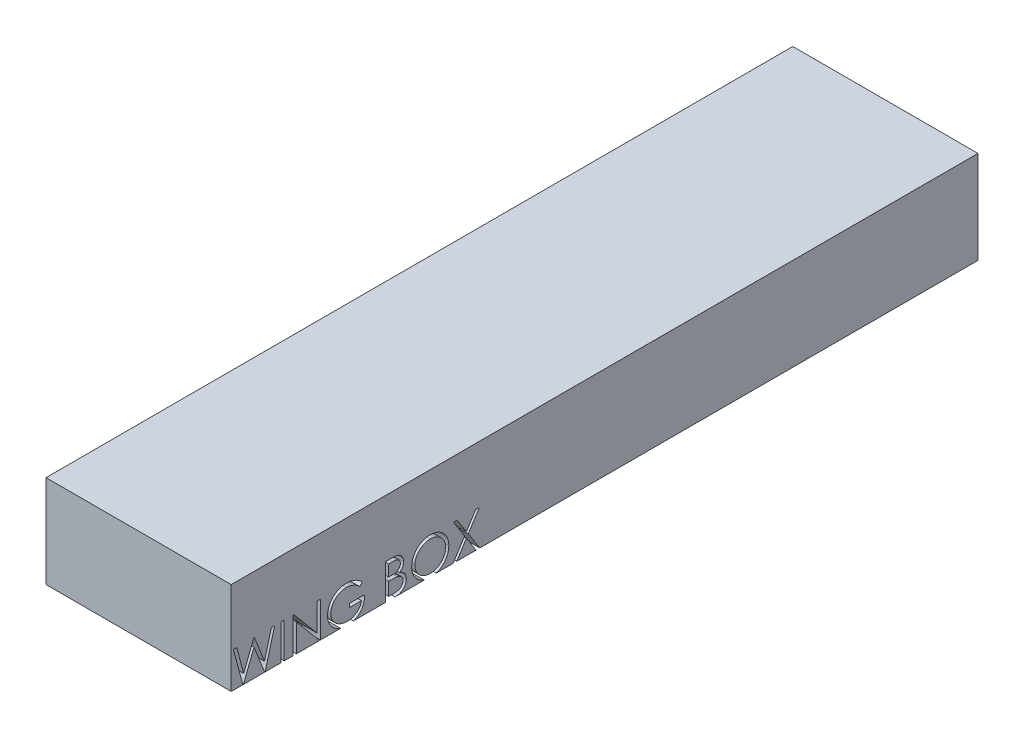
from build123d import *

# Parameters (mm, degrees)
SKETCH1_W           = 403.2
SKETCH1_H           = 50
BOSS_EXTRUDE1_DEPTH = 50
SKETCH2_W           = 1.709615385
SKETCH2_H           = 19.05
CUT_EXTRUDE1_DEPTH  = 10


with BuildPart() as part:
    # Sketch1 → Boss-Extrude1 (new, symmetric)
    with BuildSketch(Plane(origin=(0, 0, 0), x_dir=(0, 0, -1), z_dir=(1, 0, 0))):
        with Locations((-201.6, 25)):
            Rectangle(SKETCH1_W, SKETCH1_H)
    extrude(amount=BOSS_EXTRUDE1_DEPTH, both=True)

    # Sketch2 → Cut-Extrude1 (cut)
    # profile 1 of 7: a face of its own
    with BuildSketch(Plane(origin=(50, 0, 0), x_dir=(0, 0, -1), z_dir=(1, 0, 0))):
        Polygon((-401.978846154, 19.05), (-400.215805288, 19.05), (-396.483653846, 5.067788462), (-390.942668269, 19.05), (-390.694621394, 19.05), (-385.249038462, 5.174639423), (-381.501622596, 19.05), (-379.753846154, 19.05), (-384.890324519, 0), (-385.134555288, 0), (-390.866346154, 14.562259615), (-396.659194712, 0), (-396.907241587, 0), align=None)
    # profile 2 of 7: a face of its own
    with BuildSketch(Plane(origin=(50, 0, 0), x_dir=(0, 0, -1), z_dir=(1, 0, 0))):
        with Locations((-375.479807693, 9.525)):
            Rectangle(SKETCH2_W, SKETCH2_H)
    # profile 3 of 7: a face of its own
    with BuildSketch(Plane(origin=(50, 0, 0), x_dir=(0, 0, -1), z_dir=(1, 0, 0))):
        Polygon((-369.740384615, 0), (-369.740384615, 19.05), (-369.381670673, 19.05), (-356.796153846, 4.056520433), (-356.796153846, 19.05), (-355.086538462, 19.05), (-355.086538462, 0), (-355.47578125, 0), (-368.030769231, 14.959134615), (-368.030769231, 0), align=None)
    # profile 4 of 7: a face of its own
    with BuildSketch(Plane(origin=(50, 0, 0), x_dir=(0, 0, -1), z_dir=(1, 0, 0))):
        with BuildLine():
            Line((-332.373076923, 15.798677885), (-333.838461538, 14.409615385))
            add(Edge.make_bspline(
                [(-333.838461538, 14.409615385), (-334.103631487, 14.659066225), (-334.627648254, 15.152019607), (-335.481960432, 15.791615166), (-336.373302497, 16.339526369), (-337.297023373, 16.785330313), (-338.230247788, 17.141036052), (-339.160588699, 17.394282072), (-340.078503159, 17.555785455), (-340.689013305, 17.575098722), (-340.98984375, 17.584615385)],
                knots=[0, 0, 0, 0, 1.08915593, 2.152340314, 3.188132944, 4.216796309, 5.218260357, 6.173443236, 7.099959455, 8, 8, 8, 8], degree=3))
            add(Edge.make_bspline(
                [(-340.98984375, 17.584615385), (-341.174436617, 17.582364187), (-341.543143601, 17.57786763), (-342.090814468, 17.520476972), (-342.632741449, 17.437936784), (-343.167901532, 17.318510278), (-343.697335247, 17.16714954), (-344.219201247, 16.977817233), (-344.73447302, 16.757080832), (-345.238296976, 16.502015082), (-345.726741716, 16.221817632), (-346.188061065, 15.911310576), (-346.625195421, 15.580445877), (-347.029928593, 15.220939831), (-347.404588681, 14.836048921), (-347.758093391, 14.432932927), (-348.078009816, 14.00057838), (-348.366977442, 13.546940044), (-348.624759965, 13.079985414), (-348.852318494, 12.604208998), (-349.043346931, 12.121188876), (-349.194492109, 11.63031894), (-349.319191525, 11.135396729), (-349.406917358, 10.632995322), (-349.456375089, 10.122576777), (-349.464930063, 9.780780271), (-349.469230769, 9.608954327)],
                knots=[0, 0, 0, 0, 1.02818874, 2.053710826, 3.065248034, 4.081641283, 5.106893873, 6.131558223, 7.173050175, 8.228653731, 9.27666206, 10.308777013, 11.325269123, 12.329503258, 13.32196095, 14.316845687, 15.314881793, 16.315733098, 17.311955233, 18.285320748, 19.252783886, 20.203351036, 21.145449891, 22.095197417, 23.042428769, 24, 24, 24, 24], degree=3))
            add(Edge.make_bspline(
                [(-349.469230769, 9.608954327), (-349.465117503, 9.433308879), (-349.456902201, 9.082497612), (-349.404322462, 8.558927017), (-349.306741611, 8.04313247), (-349.176288795, 7.53341906), (-349.013107498, 7.028913839), (-348.809693416, 6.531804035), (-348.568762076, 6.042108049), (-348.289888843, 5.564238162), (-347.984075364, 5.098748564), (-347.641485166, 4.660274595), (-347.277572562, 4.242977393), (-346.879079764, 3.856122165), (-346.458784827, 3.489361244), (-346.004130582, 3.152799331), (-345.52405719, 2.839953573), (-345.017832222, 2.554766804), (-344.490948507, 2.299994631), (-343.950708179, 2.07344171), (-343.395385354, 1.886864175), (-342.827898429, 1.734801066), (-342.248923907, 1.610158019), (-341.655522924, 1.529971233), (-341.052058611, 1.471782568), (-340.645266914, 1.46752805), (-340.440324519, 1.465384615)],
                knots=[0, 0, 0, 0, 0.93586088, 1.869166235, 2.799637598, 3.729985548, 4.670839027, 5.622275134, 6.589130586, 7.576015415, 8.568469353, 9.55398029, 10.53834874, 11.515998671, 12.510579167, 13.508179873, 14.527009472, 15.561807829, 16.601455013, 17.643573243, 18.680854198, 19.719860599, 20.772568776, 21.833555941, 22.908541556, 24, 24, 24, 24], degree=3))
            add(Edge.make_bspline(
                [(-340.440324519, 1.465384615), (-340.193336658, 1.470547581), (-339.708335865, 1.480685902), (-338.995395369, 1.559608906), (-338.310667227, 1.682872168), (-337.656075464, 1.863389406), (-337.030859794, 2.093642266), (-336.432728213, 2.371202869), (-335.8663899, 2.706717234), (-335.330142341, 3.085397853), (-334.836163946, 3.507300013), (-334.390643642, 3.962564833), (-334.000687479, 4.448982453), (-333.66048333, 4.963687955), (-333.379040511, 5.510941686), (-333.148030441, 6.088061776), (-332.970956382, 6.695307805), (-332.898267162, 7.114906544), (-332.861538462, 7.326923077)],
                knots=[0, 0, 0, 0, 1.13008108, 2.219097802, 3.278683437, 4.311054135, 5.322181354, 6.324827112, 7.324222904, 8.330512327, 9.32562643, 10.293043162, 11.24128371, 12.174520618, 13.111833804, 14.052305215, 15.015860969, 16, 16, 16, 16], degree=3))
            Line((-332.861538462, 7.326923077), (-339.211538462, 7.326923077))
            Line((-339.211538462, 7.326923077), (-339.211538462, 9.280769231))
            Line((-339.211538462, 9.280769231), (-331.151923077, 9.280769231))
            add(Edge.make_bspline(
                [(-331.151923077, 9.280769231), (-331.161207766, 8.916601327), (-331.17937958, 8.203858957), (-331.306845392, 7.164435054), (-331.512675266, 6.182697695), (-331.793854963, 5.257612977), (-332.15784756, 4.39049185), (-332.600746608, 3.580453922), (-333.129640581, 2.832732273), (-333.72569027, 2.141222696), (-334.394617183, 1.524387984), (-335.118346386, 0.982247093), (-335.8980736, 0.525577144), (-336.733061266, 0.15404411), (-337.620575911, -0.135918634), (-338.562671235, -0.341503929), (-339.558069662, -0.464675587), (-340.240259289, -0.480412952), (-340.589152644, -0.488461538)],
                knots=[0, 0, 0, 0, 1.140356446, 2.231883559, 3.274166699, 4.278491846, 5.25512956, 6.21435461, 7.1637429, 8.11826594, 9.068280886, 10.0076534, 10.945064095, 11.891975133, 12.864533718, 13.863980011, 14.907571808, 16, 16, 16, 16], degree=3))
            add(Edge.make_bspline(
                [(-340.589152644, -0.488461538), (-340.804200667, -0.485363893), (-341.228344676, -0.479254337), (-341.854768156, -0.435834775), (-342.463919776, -0.368993353), (-343.055710796, -0.268054895), (-343.632318059, -0.144422277), (-344.190861799, 0.013892578), (-344.73346971, 0.197146499), (-345.26098046, 0.405584378), (-345.768606065, 0.647092967), (-346.258607536, 0.91547829), (-346.733693449, 1.20935644), (-347.190627647, 1.533809757), (-347.631790929, 1.886411433), (-348.054338672, 2.267868192), (-348.460636409, 2.677013858), (-348.715146932, 2.967548182), (-348.843389423, 3.113942308)],
                knots=[0, 0, 0, 0, 1.107784379, 2.184907829, 3.233506516, 4.263428166, 5.276301166, 6.270063455, 7.25232949, 8.225834625, 9.190232166, 10.146266622, 11.1027726, 12.066435141, 13.031522626, 14.010570082, 14.99756817, 16, 16, 16, 16], degree=3))
            add(Edge.make_bspline(
                [(-348.843389423, 3.113942308), (-349.029458567, 3.346192576), (-349.398508299, 3.806837998), (-349.873550837, 4.544889124), (-350.278507044, 5.309076392), (-350.607080475, 6.101527155), (-350.863646345, 6.921500185), (-351.04764895, 7.767947698), (-351.155457195, 8.641959687), (-351.170988592, 9.233409199), (-351.178846154, 9.532632212)],
                knots=[0, 0, 0, 0, 1.023165419, 2.029347347, 3.013907458, 3.994755782, 4.975994455, 5.96558838, 6.970761222, 8, 8, 8, 8], degree=3))
            add(Edge.make_bspline(
                [(-351.178846154, 9.532632212), (-351.175949258, 9.756694244), (-351.170192283, 10.201970617), (-351.100384831, 10.863045391), (-351.000228542, 11.512382015), (-350.853015287, 12.1494497), (-350.667434189, 12.774673921), (-350.435821644, 13.388344982), (-350.166155853, 13.990825026), (-349.852726224, 14.577967079), (-349.503923666, 15.141979954), (-349.125371753, 15.680593141), (-348.711695014, 16.183997909), (-348.26964902, 16.658569594), (-347.793959687, 17.098346176), (-347.289083395, 17.507399264), (-346.754631058, 17.886277561), (-346.188921278, 18.229013376), (-345.600397738, 18.536881081), (-344.990471159, 18.806788077), (-344.359327727, 19.029854408), (-343.711695884, 19.219123123), (-343.042673488, 19.359086959), (-342.357115494, 19.460589416), (-341.651448456, 19.530043537), (-341.174458068, 19.535629301), (-340.932602163, 19.538461538)],
                knots=[0, 0, 0, 0, 1.008945113, 2.00506715, 2.99143336, 3.967273523, 4.948097931, 5.927297278, 6.919902385, 7.919676788, 8.923139349, 9.905703106, 10.883022732, 11.856032218, 12.825136022, 13.798837087, 14.781400844, 15.773989409, 16.776158564, 17.77167057, 18.775803737, 19.789618931, 20.80898985, 21.851988756, 22.910860228, 24, 24, 24, 24], degree=3))
            add(Edge.make_bspline(
                [(-340.932602163, 19.538461538), (-340.73536258, 19.535307448), (-340.344259664, 19.529053256), (-339.762278179, 19.485702815), (-339.189292199, 19.416992833), (-338.624452134, 19.323229895), (-338.069681483, 19.195520379), (-337.523399844, 19.042694287), (-336.984815325, 18.864757367), (-336.455615855, 18.652546646), (-335.932243143, 18.411680488), (-335.411787126, 18.140553146), (-334.896026087, 17.834528478), (-334.384065602, 17.492697806), (-333.87267729, 17.12093206), (-333.369949737, 16.708598491), (-332.863747997, 16.271957492), (-332.538255266, 15.958001605), (-332.373076923, 15.798677885)],
                knots=[0, 0, 0, 0, 0.985871117, 1.954866573, 2.915460327, 3.869826059, 4.81536089, 5.759505086, 6.70452669, 7.649098992, 8.607881297, 9.583363685, 10.581137262, 11.603961102, 12.659522466, 13.73993555, 14.853081303, 16, 16, 16, 16], degree=3))
        make_face()
    # profile 5 of 7: a face of its own
    with BuildSketch(Plane(origin=(50, 0, 0), x_dir=(0, 0, -1), z_dir=(1, 0, 0))):
        with BuildLine():
            Line((-319.917307692, 19.05), (-316.200420673, 19.05))
            add(Edge.make_bspline(
                [(-316.200420673, 19.05), (-316.018474242, 19.049043416), (-315.665816776, 19.047189317), (-315.152993814, 19.018433989), (-314.672668144, 18.979225443), (-314.224700469, 18.917013082), (-313.809297789, 18.841946409), (-313.42520822, 18.75104081), (-313.07365314, 18.642038813), (-312.653939532, 18.468704053), (-312.175399935, 18.211130809), (-311.657248683, 17.830519618), (-311.214177037, 17.36497864), (-310.832162939, 16.83983733), (-310.528445417, 16.262155487), (-310.308721099, 15.645701902), (-310.169613234, 14.99842785), (-310.155307042, 14.554055696), (-310.148076923, 14.329477163)],
                knots=[0, 0, 0, 0, 1.001505555, 1.941167018, 2.826882275, 3.653841531, 4.429895133, 5.150066043, 5.825578002, 6.45369114, 7.647487171, 8.808567382, 9.977351308, 11.170798116, 12.373658725, 13.556498008, 14.765093433, 16, 16, 16, 16], degree=3))
            add(Edge.make_bspline(
                [(-310.148076923, 14.329477163), (-310.154027155, 14.119096825), (-310.165719922, 13.705679619), (-310.277531226, 13.101010253), (-310.45257715, 12.525421476), (-310.695901435, 11.981013921), (-311.0121423, 11.480088113), (-311.386928291, 11.018603136), (-311.839103459, 10.616098097), (-312.177884522, 10.391074585), (-312.349969952, 10.276772837)],
                knots=[0, 0, 0, 0, 1.044552857, 2.05264487, 3.044412934, 4.028983338, 5.005914585, 5.980388656, 6.974128949, 8, 8, 8, 8], degree=3))
            add(Edge.make_bspline(
                [(-312.349969952, 10.276772837), (-312.133559625, 10.193687628), (-311.71951306, 10.034725042), (-311.149722049, 9.753680588), (-310.658804393, 9.447998245), (-310.242985641, 9.114177746), (-309.887362119, 8.754356933), (-309.576831109, 8.363259811), (-309.311865344, 7.935784572), (-309.08482786, 7.476388187), (-308.90766963, 6.989761552), (-308.774995065, 6.480469185), (-308.698972235, 5.95033732), (-308.688153787, 5.589555469), (-308.682692308, 5.407421875)],
                knots=[0, 0, 0, 0, 1.27268992, 2.434971085, 3.483601985, 4.442670788, 5.356604649, 6.2567628, 7.179492994, 8.113709626, 9.066344395, 10.018646069, 10.999752585, 12, 12, 12, 12], degree=3))
            add(Edge.make_bspline(
                [(-308.682692308, 5.407421875), (-308.688009141, 5.221456471), (-308.69847016, 4.855564329), (-308.77564972, 4.318054239), (-308.90632786, 3.804384887), (-309.086329385, 3.311233821), (-309.321255697, 2.839555089), (-309.607157903, 2.388814324), (-309.948052557, 1.963540324), (-310.329394743, 1.559007461), (-310.760807278, 1.195273362), (-311.226257316, 0.871337873), (-311.731606571, 0.604931449), (-312.268555281, 0.381142817), (-312.843126773, 0.210197923), (-313.452740965, 0.090604342), (-314.096872093, 0.010022641), (-314.538885167, 0.003397568), (-314.765564904, 0)],
                knots=[0, 0, 0, 0, 0.978564426, 1.925352924, 2.850884081, 3.763762016, 4.682927383, 5.618979971, 6.567305752, 7.547517671, 8.540179244, 9.531824382, 10.526200242, 11.540722885, 12.589160233, 13.674978461, 14.80764778, 16, 16, 16, 16], degree=3))
            Line((-314.765564904, 0), (-319.917307692, 0))
            Line((-319.917307692, 0), (-319.917307692, 19.05))
        make_face()
        with BuildLine():
            Line((-318.207692308, 17.096153846), (-318.207692308, 10.990384615))
            Line((-318.207692308, 10.990384615), (-317.059044471, 10.990384615))
            add(Edge.make_bspline(
                [(-317.059044471, 10.990384615), (-316.891138885, 10.992561339), (-316.566711075, 10.996767213), (-316.09688421, 11.00881507), (-315.660775182, 11.042550135), (-315.259136776, 11.076275504), (-314.892601474, 11.131110046), (-314.561981314, 11.196381458), (-314.262087522, 11.265412698), (-313.916250853, 11.382812334), (-313.52396809, 11.556317966), (-313.105776481, 11.825586103), (-312.737107439, 12.146302939), (-312.425791317, 12.516368031), (-312.17100317, 12.923853986), (-311.994035664, 13.362259149), (-311.874035445, 13.820657296), (-311.863195825, 14.135353787), (-311.857692308, 14.295132212)],
                knots=[0, 0, 0, 0, 1.156816544, 2.235205308, 3.236616184, 4.169592532, 5.011045266, 5.787822928, 6.49130361, 7.128639758, 8.301311294, 9.436451833, 10.541879658, 11.654887649, 12.756523258, 13.837046038, 14.901820046, 16, 16, 16, 16], degree=3))
            add(Edge.make_bspline(
                [(-311.857692308, 14.295132212), (-311.860556231, 14.400863911), (-311.86617413, 14.608268185), (-311.912184249, 14.910615384), (-311.990384904, 15.194970665), (-312.090828985, 15.465230894), (-312.231193134, 15.712945393), (-312.396457127, 15.946679073), (-312.596132099, 16.158472175), (-312.823411186, 16.356426159), (-313.084715262, 16.531928517), (-313.379888436, 16.685638957), (-313.712924221, 16.809413755), (-314.078209903, 16.917814528), (-314.481368251, 16.993950813), (-314.917746892, 17.057378537), (-315.390920148, 17.089669604), (-315.718281349, 17.093944222), (-315.8875, 17.096153846)],
                knots=[0, 0, 0, 0, 0.91205012, 1.789085906, 2.630437955, 3.453916878, 4.269457761, 5.079663411, 5.91843418, 6.774407191, 7.675494373, 8.627863946, 9.638891023, 10.736472738, 11.911756761, 13.175263542, 14.539845004, 16, 16, 16, 16], degree=3))
            Line((-315.8875, 17.096153846), (-318.207692308, 17.096153846))
        make_face(mode=Mode.SUBTRACT)
        with BuildLine():
            Line((-318.207692308, 9.036538462), (-318.207692308, 1.953846154))
            Line((-318.207692308, 1.953846154), (-315.773016827, 1.953846154))
            add(Edge.make_bspline(
                [(-315.773016827, 1.953846154), (-315.598742387, 1.955934836), (-315.26285138, 1.959960496), (-314.777886113, 1.973102571), (-314.328398077, 2.002996243), (-313.916438367, 2.050054368), (-313.537558617, 2.101099927), (-313.196303976, 2.169741327), (-312.889908166, 2.248384955), (-312.534629434, 2.369946664), (-312.134560339, 2.558794599), (-311.703426964, 2.84353346), (-311.320107119, 3.182750321), (-310.994595637, 3.575348582), (-310.727824942, 4.00223909), (-310.533757394, 4.454787352), (-310.414064302, 4.925515723), (-310.399574495, 5.246463115), (-310.392307692, 5.407421875)],
                knots=[0, 0, 0, 0, 1.160039823, 2.235823828, 3.228722157, 4.157150951, 4.99529583, 5.772374946, 6.472645482, 7.099169577, 8.269452708, 9.405989375, 10.527446681, 11.663510218, 12.788923519, 13.866172445, 14.929861265, 16, 16, 16, 16], degree=3))
            add(Edge.make_bspline(
                [(-310.392307692, 5.407421875), (-310.393810489, 5.508078486), (-310.396791841, 5.707768106), (-310.441753188, 6.001224208), (-310.507142965, 6.285482176), (-310.591678341, 6.561313877), (-310.714792869, 6.823732397), (-310.858519921, 7.077927757), (-311.027038408, 7.324235981), (-311.28962451, 7.635634103), (-311.671560598, 7.994410988), (-312.214250332, 8.345679393), (-312.831319554, 8.628968171), (-313.278872051, 8.749252464), (-313.510066106, 8.811388221)],
                knots=[0, 0, 0, 0, 0.723448775, 1.435228256, 2.130040452, 2.821711965, 3.505591119, 4.210454504, 4.921174351, 5.648778258, 7.137944449, 8.670945889, 10.280296675, 12, 12, 12, 12], degree=3))
            add(Edge.make_bspline(
                [(-313.510066106, 8.811388221), (-313.602753042, 8.83019375), (-313.803717437, 8.870968014), (-314.131418696, 8.914008514), (-314.505538211, 8.952353768), (-314.926939872, 8.980717355), (-315.396156836, 9.010035542), (-315.914191207, 9.021437354), (-316.478927449, 9.03504047), (-316.870771647, 9.036026358), (-317.074308894, 9.036538462)],
                knots=[0, 0, 0, 0, 0.634451884, 1.375622551, 2.216452059, 3.157844607, 4.20941857, 5.370758133, 6.634282058, 8, 8, 8, 8], degree=3))
            Line((-317.074308894, 9.036538462), (-318.207692308, 9.036538462))
        make_face(mode=Mode.SUBTRACT)
    # profile 6 of 7: a face of its own
    with BuildSketch(Plane(origin=(50, 0, 0), x_dir=(0, 0, -1), z_dir=(1, 0, 0))):
        with BuildLine():
            add(Edge.make_bspline(
                [(-295.860576923, 19.538461538), (-295.507835661, 19.529527201), (-294.815022719, 19.511979424), (-293.796800776, 19.377654589), (-292.824733186, 19.145269681), (-291.89090143, 18.835772591), (-291.006475372, 18.422908007), (-290.164797972, 17.923878843), (-289.367871844, 17.333456974), (-288.626438325, 16.656206468), (-287.947948352, 15.919333669), (-287.350181743, 15.132961044), (-286.849208687, 14.301843278), (-286.437806045, 13.428477899), (-286.115052184, 12.514840074), (-285.892335675, 11.556059002), (-285.750069458, 10.558346874), (-285.733437298, 9.87784351), (-285.725, 9.532632212)],
                knots=[0, 0, 0, 0, 1.065120563, 2.091984664, 3.0946048, 4.079830382, 5.057816894, 6.036188127, 7.030412546, 8.04752943, 9.064399622, 10.05169764, 11.02544977, 11.989514704, 12.962713494, 13.945757189, 14.957906945, 16, 16, 16, 16], degree=3))
            add(Edge.make_bspline(
                [(-285.725, 9.532632212), (-285.733436061, 9.189963825), (-285.750064515, 8.514524737), (-285.892497433, 7.52314399), (-286.115877733, 6.570150342), (-286.434808839, 5.657134718), (-286.844250372, 4.783133978), (-287.348559232, 3.950447843), (-287.94259925, 3.158803331), (-288.618639397, 2.416872967), (-289.355607925, 1.736529591), (-290.14607552, 1.143699711), (-290.972264876, 0.633572689), (-291.844807716, 0.226535835), (-292.752132202, -0.098794189), (-293.702358846, -0.320604932), (-294.691035091, -0.463681553), (-295.365247268, -0.480110904), (-295.707932692, -0.488461538)],
                knots=[0, 0, 0, 0, 1.043624062, 2.057103931, 3.04512605, 4.022047818, 4.998200453, 5.980619268, 6.982898556, 8.009068085, 9.034988726, 10.034168286, 11.015286542, 11.987931943, 12.962482838, 13.94673481, 14.956375938, 16, 16, 16, 16], degree=3))
            add(Edge.make_bspline(
                [(-295.707932692, -0.488461538), (-296.0531422, -0.480028447), (-296.733642032, -0.463404579), (-297.732607896, -0.320902933), (-298.692062474, -0.098065265), (-299.609262014, 0.220393237), (-300.484717988, 0.631967022), (-301.320142581, 1.133822285), (-302.112182511, 1.729309725), (-302.854271159, 2.405130652), (-303.533263224, 3.1408501), (-304.125224969, 3.929162259), (-304.627193085, 4.754601245), (-305.037384938, 5.619457769), (-305.362130067, 6.519550907), (-305.583680577, 7.460884763), (-305.727023402, 8.438092645), (-305.743541638, 9.103443277), (-305.751923077, 9.441045673)],
                knots=[0, 0, 0, 0, 1.053102029, 2.075944431, 3.073151272, 4.055350789, 5.033113405, 6.020478099, 7.024410459, 8.052272461, 9.079885166, 10.07527673, 11.055994387, 12.023226415, 12.992069828, 13.970394897, 14.97016774, 16, 16, 16, 16], degree=3))
            add(Edge.make_bspline(
                [(-305.751923077, 9.441045673), (-305.749013132, 9.667646344), (-305.743229953, 10.117989016), (-305.673606598, 10.786734368), (-305.57257791, 11.444724948), (-305.427787501, 12.090089679), (-305.238421428, 12.721248753), (-305.014981107, 13.342555048), (-304.742077092, 13.947712173), (-304.433572422, 14.539586919), (-304.089247438, 15.108952807), (-303.708923716, 15.647140252), (-303.305959782, 16.158665392), (-302.864199025, 16.630272656), (-302.398200945, 17.075681557), (-301.900406058, 17.488047202), (-301.373851842, 17.871088007), (-300.816272604, 18.216275863), (-300.241407422, 18.528473439), (-299.648806674, 18.796380942), (-299.046518764, 19.02632022), (-298.431722751, 19.21268814), (-297.806051235, 19.35981965), (-297.168138665, 19.460008247), (-296.518493244, 19.529809177), (-296.080825923, 19.535565009), (-295.860576923, 19.538461538)],
                knots=[0, 0, 0, 0, 1.037015668, 2.060948919, 3.074880161, 4.083647147, 5.086022904, 6.090072063, 7.104153813, 8.122640571, 9.144368836, 10.147691507, 11.138137339, 12.123020368, 13.103399296, 14.087645067, 15.080126199, 16.082011238, 17.087798457, 18.072939717, 19.057185487, 20.037253025, 21.01195951, 21.997135196, 22.992090687, 24, 24, 24, 24], degree=3))
        make_face()
        with BuildLine():
            add(Edge.make_bspline(
                [(-295.776622596, 17.584615385), (-295.957405102, 17.582411625), (-296.317241819, 17.578025173), (-296.85219051, 17.52024535), (-297.380103749, 17.437895526), (-297.901090564, 17.320430391), (-298.412971081, 17.160388333), (-298.920516646, 16.976197104), (-299.419098982, 16.751836596), (-299.907072122, 16.49834802), (-300.38013846, 16.217774608), (-300.826521878, 15.907685419), (-301.247377983, 15.575352431), (-301.641676334, 15.220000059), (-302.008259143, 14.839818655), (-302.354341589, 14.440571824), (-302.666051741, 14.01084796), (-302.951723237, 13.562299888), (-303.207362482, 13.095511853), (-303.434685342, 12.615398174), (-303.620635161, 12.118042479), (-303.772286095, 11.608840564), (-303.898015065, 11.088598891), (-303.977665423, 10.553370914), (-304.036080123, 10.00584609), (-304.040215853, 9.63583057), (-304.042307692, 9.448677885)],
                knots=[0, 0, 0, 0, 1.008559885, 2.007477868, 2.99961109, 3.989939068, 4.984837346, 5.991145699, 7.001802488, 8.033829008, 9.059044045, 10.069351652, 11.065060232, 12.050310815, 13.029377138, 14.011219647, 14.996725999, 15.989392538, 16.977580475, 17.965360261, 18.951710183, 19.937753436, 20.929683414, 21.935841486, 22.955955122, 24, 24, 24, 24], degree=3))
            add(Edge.make_bspline(
                [(-304.042307692, 9.448677885), (-304.035368801, 9.17347494), (-304.021717855, 8.632065611), (-303.902205937, 7.838670428), (-303.718117762, 7.076189898), (-303.446751239, 6.348796077), (-303.107385751, 5.650236481), (-302.688139391, 4.986708082), (-302.191429225, 4.358031552), (-301.627203459, 3.768595874), (-301.010404156, 3.230592282), (-300.355450297, 2.758351444), (-299.669358519, 2.358789941), (-298.950339659, 2.033279476), (-298.202232339, 1.775343903), (-297.420215954, 1.598567353), (-296.609499881, 1.482223803), (-296.05688303, 1.471050946), (-295.776622596, 1.465384615)],
                knots=[0, 0, 0, 0, 1.032063989, 2.030389145, 3.003944642, 3.970395727, 4.937377036, 5.913328081, 6.909231446, 7.93887556, 8.970685674, 9.976071282, 10.964166581, 11.944589148, 12.933237628, 13.927779006, 14.949070134, 16, 16, 16, 16], degree=3))
            add(Edge.make_bspline(
                [(-295.776622596, 1.465384615), (-295.588248023, 1.467972718), (-295.214644668, 1.473105702), (-294.658953325, 1.524805643), (-294.113273087, 1.607710532), (-293.578369335, 1.727075958), (-293.054849147, 1.876467181), (-292.540527433, 2.053946386), (-292.040882453, 2.275368366), (-291.54961105, 2.520013646), (-291.079368649, 2.798906503), (-290.630466109, 3.098471289), (-290.214218276, 3.430314782), (-289.820214901, 3.780387447), (-289.452127051, 4.155747819), (-289.112443865, 4.555907884), (-288.802309146, 4.983393461), (-288.516746127, 5.431261169), (-288.262002654, 5.899326488), (-288.040047843, 6.381180878), (-287.851746127, 6.87563783), (-287.699735265, 7.383410526), (-287.580615824, 7.903534575), (-287.498537974, 8.4367064), (-287.441124329, 8.981859393), (-287.436796838, 9.350579523), (-287.434615385, 9.536448317)],
                knots=[0, 0, 0, 0, 1.047197238, 2.076906641, 3.100256066, 4.114471768, 5.12198147, 6.126382909, 7.136867548, 8.15857795, 9.17633901, 10.174870724, 11.156907918, 12.133735059, 13.104061851, 14.077631395, 15.04955518, 16.038496417, 17.029181396, 18.010275684, 18.986308667, 19.968651475, 20.955262928, 21.950658345, 22.966943676, 24, 24, 24, 24], degree=3))
            add(Edge.make_bspline(
                [(-287.434615385, 9.536448317), (-287.436798585, 9.721045562), (-287.441129366, 10.087228201), (-287.498510549, 10.628579226), (-287.580702538, 11.157914563), (-287.699153849, 11.673156119), (-287.851826829, 12.174435234), (-288.040080727, 12.661281104), (-288.262069286, 13.135507423), (-288.516839764, 13.595942097), (-288.803220175, 14.037764599), (-289.116153127, 14.460143445), (-289.461041665, 14.855146508), (-289.828031886, 15.232525343), (-290.226290562, 15.584231285), (-290.654013649, 15.910381004), (-291.106008523, 16.21884554), (-291.584583905, 16.497114669), (-292.078490281, 16.754094993), (-292.585296253, 16.974264025), (-293.099260352, 17.16134656), (-293.619075592, 17.320914613), (-294.149117231, 17.437435463), (-294.685803785, 17.520319563), (-295.228392736, 17.578005063), (-295.593299403, 17.582404952), (-295.776622596, 17.584615385)],
                knots=[0, 0, 0, 0, 1.02996197, 2.043119294, 3.035359645, 4.018872909, 4.991431989, 5.957985074, 6.929999688, 7.912076566, 8.892894881, 9.867085534, 10.843653904, 11.817741046, 12.803660682, 13.806313499, 14.818574707, 15.856120519, 16.894564902, 17.924820532, 18.937903209, 19.946497019, 20.957711757, 21.963978472, 22.977135795, 24, 24, 24, 24], degree=3))
        make_face(mode=Mode.SUBTRACT)
    # profile 7 of 7: a face of its own
    with BuildSketch(Plane(origin=(50, 0, 0), x_dir=(0, 0, -1), z_dir=(1, 0, 0))):
        Polygon((-283.160576923, 19.05), (-281.18765024, 19.05), (-276.203816106, 11.261328125), (-271.223798077, 19.05), (-269.239423077, 19.05), (-275.211628606, 9.715805288), (-268.995192308, 0), (-270.96811899, 0), (-276.2, 8.174098558), (-281.428064904, 0), (-283.404807692, 0), (-277.188371394, 9.719621394), align=None)
    extrude(amount=-CUT_EXTRUDE1_DEPTH, mode=Mode.SUBTRACT)


solid = part.part
